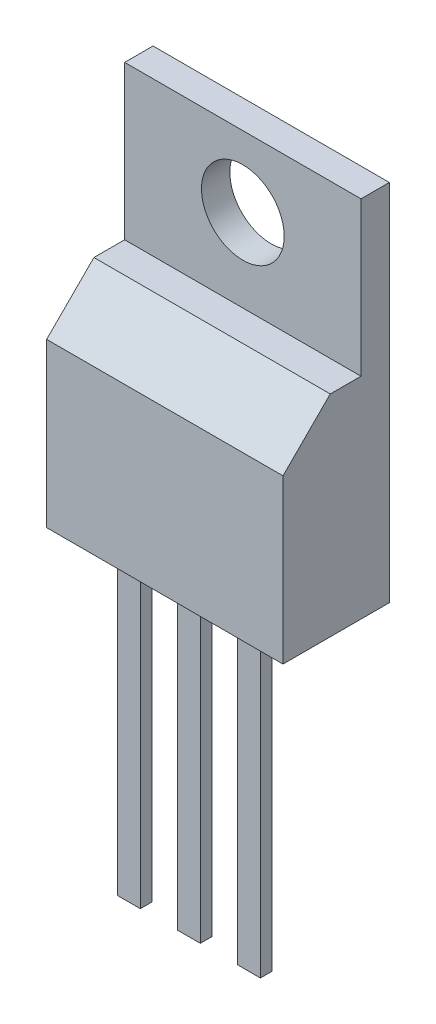
from build123d import *

# Parameters (mm, degrees)
SKETCH_1_W          = 10
SKETCH_1_H          = 15.4
EXTRUDE_1_DEPTH     = 4.5
SKETCH_2_W          = 10
SKETCH_2_H          = 6.5
CUT_EXTRUDE_1_DEPTH = 3.3
CHAMFER_1_SIZE      = 2
SKETCH_3_R          = 1.75
CUT_EXTRUDE_2_DEPTH = 17.524224641
SKETCH_4_W          = 0.965597518
SKETCH_4_H          = 0.5
EXTRUDE_2_DEPTH     = 13


with BuildPart() as part:
    # 草图1 → 凸台-拉伸1 (new body)
    with BuildSketch(Plane.XY):
        with Locations((0, 7.7)):
            Rectangle(SKETCH_1_W, SKETCH_1_H)
    extrude(amount=EXTRUDE_1_DEPTH)

    # 草图2 → 切除-拉伸1 (cut)
    with BuildSketch(Plane.XY.offset(4.5)):
        with Locations((0, 12.15)):
            Rectangle(SKETCH_2_W, SKETCH_2_H)
    extrude(amount=-CUT_EXTRUDE_1_DEPTH, mode=Mode.SUBTRACT)

    # 倒角1
    chamfer_1_edges = [part.edges().sort_by_distance(p)[0] for p in [
        (0, 8.9, 4.5),
    ]]
    chamfer(chamfer_1_edges, length=CHAMFER_1_SIZE)

    # 草图3 → 切除-拉伸2 (cut, through all)
    with BuildSketch(Plane.XY.offset(1.2)):
        with Locations((0, 12.4)):
            Circle(SKETCH_3_R)
    extrude(amount=-CUT_EXTRUDE_2_DEPTH, mode=Mode.SUBTRACT)

    # 草图4 → 凸台-拉伸2 (add)
    with BuildSketch(Plane.XZ):
        with Locations((2.54, 3.23)):
            Rectangle(SKETCH_4_W, SKETCH_4_H)
        with Locations((0, 3.23)):
            Rectangle(SKETCH_4_W, SKETCH_4_H)
        with Locations((-2.54, 3.23)):
            Rectangle(SKETCH_4_W, SKETCH_4_H)
    extrude(amount=EXTRUDE_2_DEPTH)


solid = part.part
